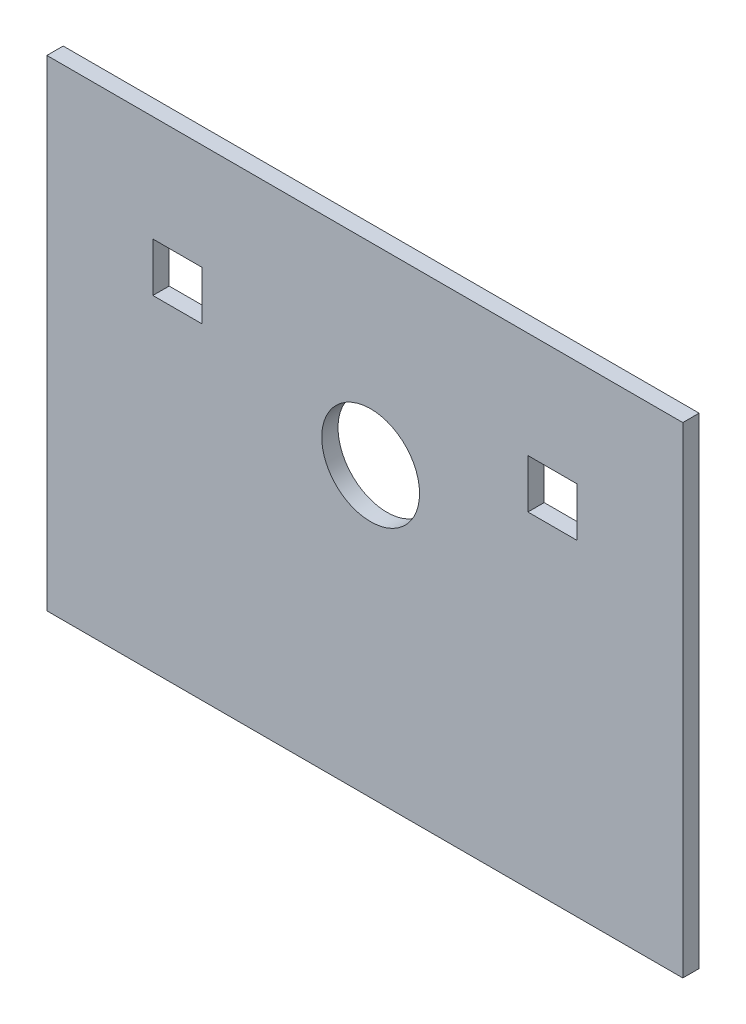
from build123d import *

# Parameters (mm, degrees)
SKETCH1_W           = 78
SKETCH1_H           = 59
SKETCH1_R           = 6.000383827
SKETCH1_W_2         = 6
SKETCH1_H_2         = 6
BOSS_EXTRUDE1_DEPTH = 2


with BuildPart() as part:
    # Sketch1 → Boss-Extrude1 (new body)
    with BuildSketch(Plane.XY):
        Rectangle(SKETCH1_W, SKETCH1_H)
        with Locations((0.71, 5.82)):
            Circle(SKETCH1_R, mode=Mode.SUBTRACT)
        with Locations((-23, 13.5)):
            Rectangle(SKETCH1_W_2, SKETCH1_H_2, mode=Mode.SUBTRACT)
        with Locations((23, 13.5)):
            Rectangle(SKETCH1_W_2, SKETCH1_H_2, mode=Mode.SUBTRACT)
    extrude(amount=-BOSS_EXTRUDE1_DEPTH)


solid = part.part
